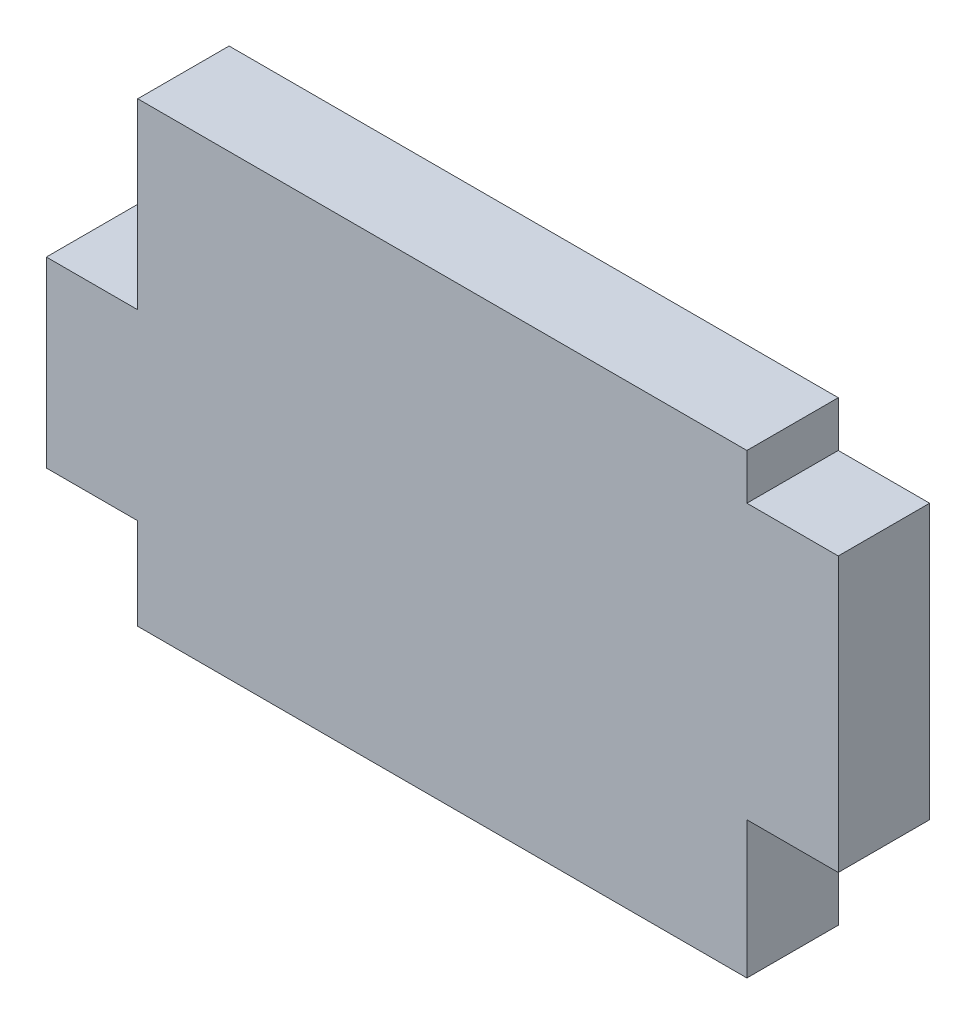
from build123d import *

# Parameters (mm, degrees)
ESQUISSE1_W             = 52
ESQUISSE1_H             = 30
BOSS_EXTRU_1_DEPTH      = 6
ESQUISSE2_W             = 6
ESQUISSE2_H             = 3
ESQUISSE2_H_2           = 9
ESQUISSE2_H_3           = 12
ESQUISSE2_H_4           = 6
ENL_V_MAT_EXTRU_1_DEPTH = 61.332412516


with BuildPart() as part:
    # Esquisse1 → Boss.-Extru.1 (new body)
    with BuildSketch(Plane.XY):
        with Locations((26, 15)):
            Rectangle(ESQUISSE1_W, ESQUISSE1_H)
    extrude(amount=BOSS_EXTRU_1_DEPTH)

    # Esquisse2 → Enlèv. mat.-Extru.1 (cut, through all)
    with BuildSketch(Plane.XY.offset(6)):
        with Locations((49, 28.5)):
            Rectangle(ESQUISSE2_W, ESQUISSE2_H)
        with Locations((49, 4.5)):
            Rectangle(ESQUISSE2_W, ESQUISSE2_H_2)
        with Locations((3, 24)):
            Rectangle(ESQUISSE2_W, ESQUISSE2_H_3)
        with Locations((3, 3)):
            Rectangle(ESQUISSE2_W, ESQUISSE2_H_4)
    extrude(amount=-ENL_V_MAT_EXTRU_1_DEPTH, mode=Mode.SUBTRACT)


solid = part.part
